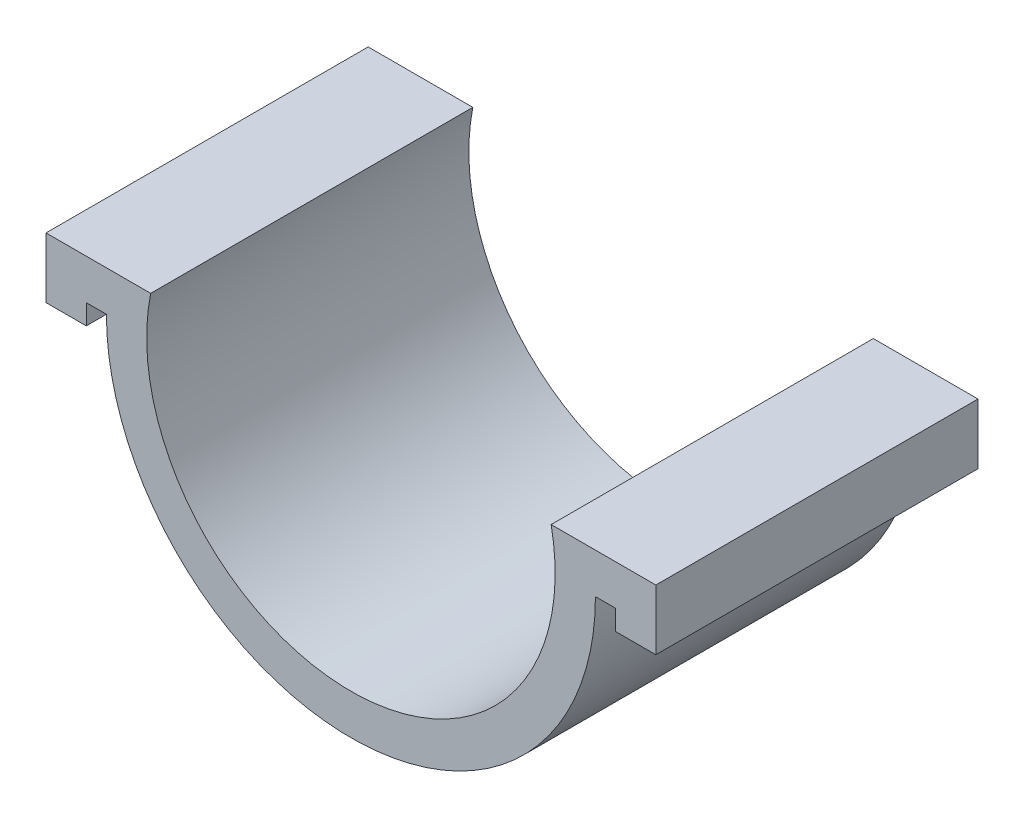
from build123d import *

# Parameters (mm, degrees)
EXTRUDE_THIN1_DEPTH = 80


with BuildPart() as part:
    # Sketch1 → Extrude-Thin1 (new body)
    with BuildSketch(Plane.XY):
        with BuildLine():
            Line((-65.719243559, 195), (-65.719243559, 200))
            Line((-65.719243559, 200), (-60.719243559, 200))
            ThreePointArc((-60.719243559, 200), (0, 139.280756441), (60.719243559, 200))
            Line((60.719243559, 200), (65.721997063, 200))
            Line((65.721997063, 200), (65.721997063, 195))
            Line((65.721997063, 195), (75.721997063, 195))
            Line((75.721997063, 195), (75.721997063, 210))
            Line((75.721997063, 210), (49.723652996, 210))
            ThreePointArc((49.723652996, 210), (0, 149.280756441), (-49.723652996, 210))
            Line((-49.723652996, 210), (-75.719243559, 210))
            Line((-75.719243559, 210), (-75.719243559, 195))
            Line((-75.719243559, 195), (-65.719243559, 195))
        make_face()
    extrude(amount=EXTRUDE_THIN1_DEPTH)


solid = part.part
